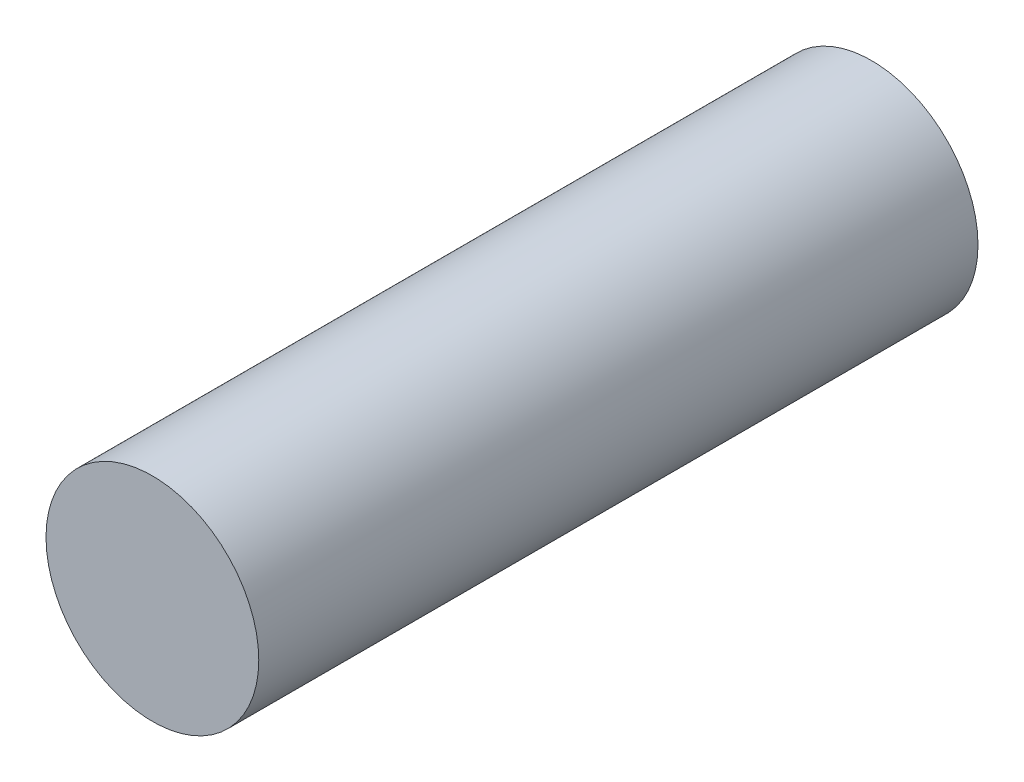
from build123d import *

# Parameters (mm, degrees)
SKETCH1_R           = 7.1
BOSS_EXTRUDE1_DEPTH = 48
SKETCH2_R           = 2.5
BOSS_EXTRUDE2_DEPTH = 2


with BuildPart() as part:
    # Sketch1 → Boss-Extrude1 (new body)
    with BuildSketch(Plane.XY):
        Circle(SKETCH1_R)
    extrude(amount=BOSS_EXTRUDE1_DEPTH)

    # Sketch2 → Boss-Extrude2 (add)
    with BuildSketch(Plane(origin=(0, 0, 0), x_dir=(-1, 0, 0), z_dir=(0, 0, -1))):
        with Locations(Location((0, 0, 0), (0, 0, 180))):
            Circle(SKETCH2_R)
    extrude(amount=BOSS_EXTRUDE2_DEPTH)


solid = part.part
